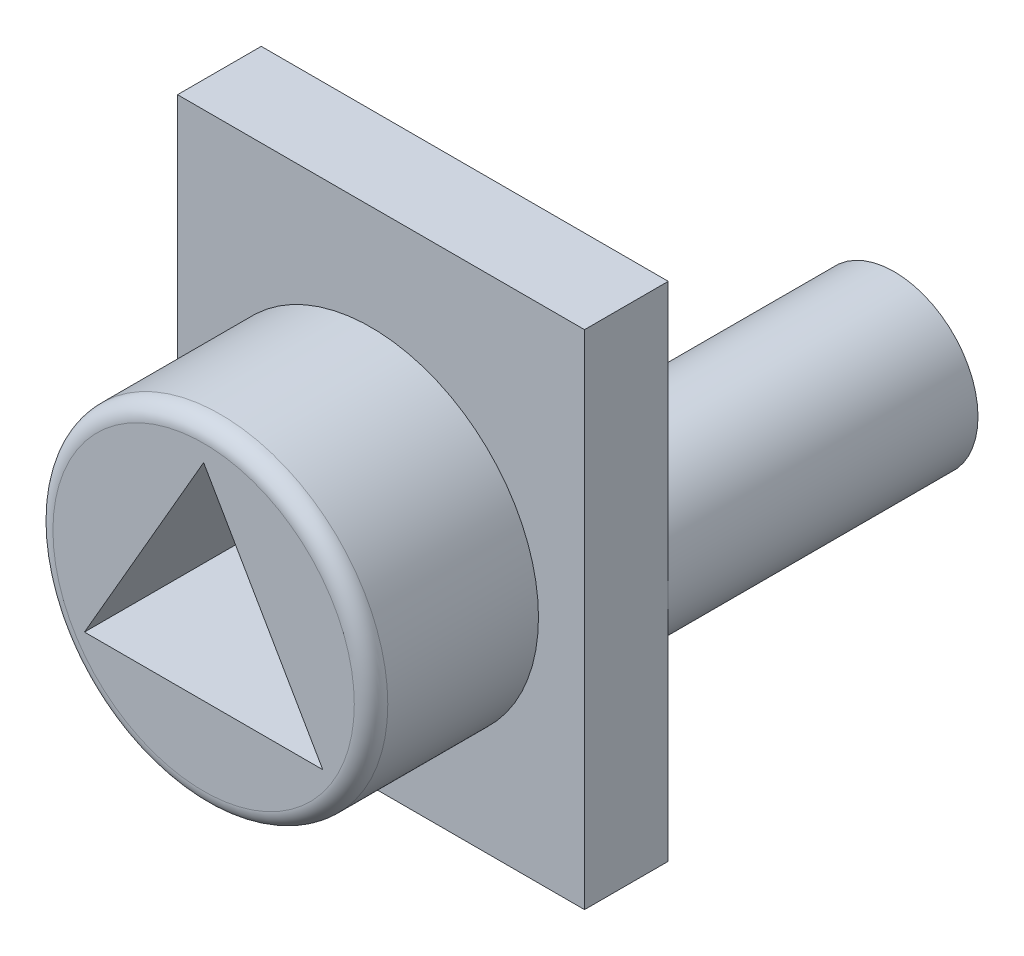
from build123d import *

# Parameters (mm, degrees)
SKETCH_2_W          = 9.723167254
SKETCH_2_H          = 12
EXTRUDE_1_DEPTH     = 2
SKETCH_3_R          = 4
EXTRUDE_2_DEPTH     = 4
SKETCH_4_R          = 2
EXTRUDE_3_DEPTH     = 7.4
FILLET_1_R          = 0.4
SKETCH_5_R          = 1.1
CUT_EXTRUDE_1_DEPTH = 2


with BuildPart() as part:
    # Эскиз2 → Бобышка-Вытянуть1 (new body)
    with BuildSketch(Plane.XY):
        Rectangle(SKETCH_2_W, SKETCH_2_H)
    extrude(amount=EXTRUDE_1_DEPTH)

    # Эскиз3 → Бобышка-Вытянуть2 (add)
    with BuildSketch(Plane.XY.offset(2)):
        with Locations((-0.238416373, -0.5)):
            Circle(SKETCH_3_R)
        Polygon((-3.084826535, -2.230127019), (-0.238416373, 2.7), (2.607993788, -2.230127019), align=None, mode=Mode.SUBTRACT)
    extrude(amount=EXTRUDE_2_DEPTH)

    # Эскиз4 → Бобышка-Вытянуть3 (add)
    with BuildSketch(Plane(origin=(0, 0, 0), x_dir=(-1, 0, 0), z_dir=(0, 0, -1))):
        with Locations(Location((-2.861583627, -0.5, 0), (0, 0, 180))):
            Circle(SKETCH_4_R)
    extrude(amount=EXTRUDE_3_DEPTH)

    # Скругление1
    fillet_1_edges = [part.edges().sort_by_distance(p)[0] for p in [
        (-4.238416373, -0.5, 6),
    ]]
    fillet(fillet_1_edges, radius=FILLET_1_R)

    # Эскиз5 → Вырез-Вытянуть1 (cut)
    with BuildSketch(Plane.XY.offset(2)):
        with Locations((-0.238416373, -0.58)):
            Circle(SKETCH_5_R)
    extrude(amount=-CUT_EXTRUDE_1_DEPTH, mode=Mode.SUBTRACT)


solid = part.part
